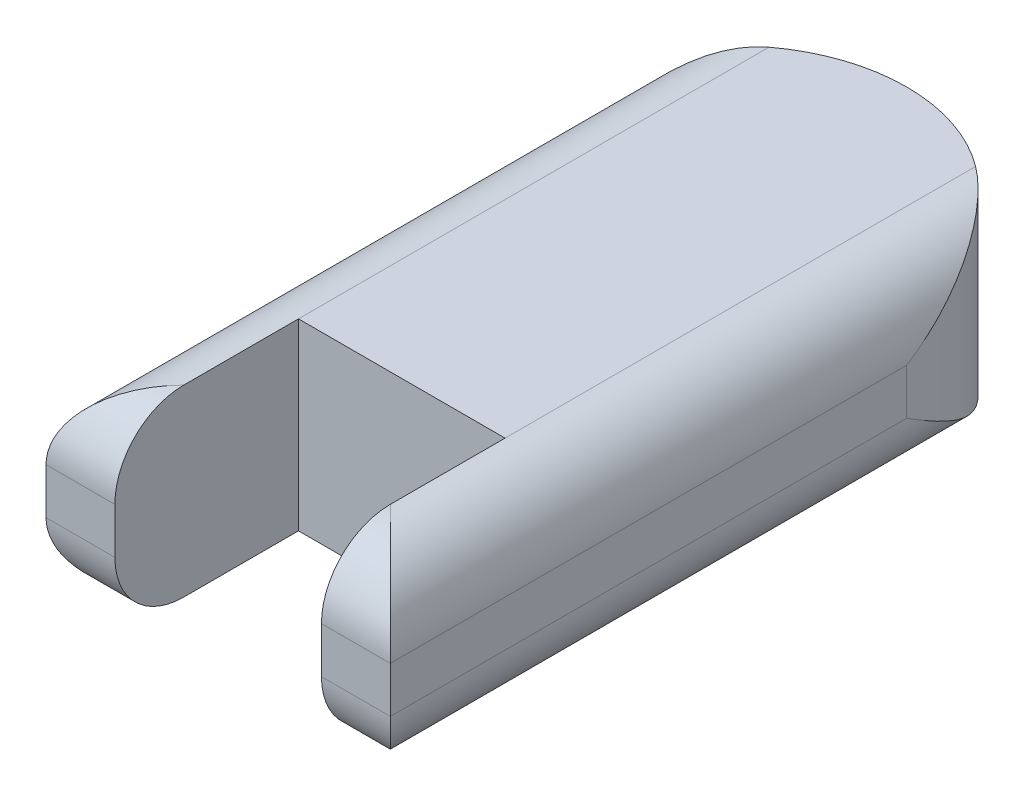
from build123d import *

# Parameters (mm, degrees)
BOSS_EXTRUDE1_DEPTH      = 150
BOSS_EXTRUDE1_DEPTH_BACK = 150
SKETCH2_OUTSIDE_W        = 370.964
SKETCH2_OUTSIDE_H        = 150.964
CUT_EXTRUDE1_DEPTH       = 150
CUT_EXTRUDE2_REACH       = 187.809
SKETCH6_OUTSIDE_W        = 220.96400000000003
SKETCH6_OUTSIDE_H        = 370.964
CUT_EXTRUDE3_DEPTH       = 186.8090417606205


with BuildPart() as part:
    # Sketch1 → Boss-Extrude1 (new, two sides: drawn at the far end of the back side and taken through both)
    with BuildSketch(Plane.XY.offset(-BOSS_EXTRUDE1_DEPTH_BACK)):
        with BuildLine():
            Line((-44.999999999999986, -39.99999999999999), (45.000000000000014, -39.99999999999999))
            ThreePointArc((45.000000000000014, -39.99999999999999), (66.21320343559644, -31.21320343559642), (75.00000000000001, -10.000000000000002))
            Line((75.00000000000001, -10.000000000000002), (75.00000000000001, 10.000000000000002))
            ThreePointArc((75.00000000000001, 10.000000000000002), (66.21320343559645, 31.213203435596434), (45.000000000000014, 40.00000000000001))
            Line((45.000000000000014, 40.00000000000001), (-44.999999999999986, 40.00000000000001))
            ThreePointArc((-44.999999999999986, 40.00000000000001), (-66.21320343559641, 31.213203435596427), (-74.99999999999999, 10.000000000000002))
            Line((-74.99999999999999, 10.000000000000002), (-74.99999999999999, -10.000000000000002))
            ThreePointArc((-74.99999999999999, -10.000000000000002), (-66.2132034355964, -31.213203435596427), (-44.999999999999986, -39.99999999999999))
        make_face()
    extrude(amount=BOSS_EXTRUDE1_DEPTH + BOSS_EXTRUDE1_DEPTH_BACK)

    # Sketch2 outside → Cut-Extrude1 (cut)
    with BuildSketch(Plane(origin=(75.00000000000001, 0, 0), x_dir=(0, 0, -1), z_dir=(1, 0, 0))):
        Rectangle(SKETCH2_OUTSIDE_W, SKETCH2_OUTSIDE_H)
        with BuildLine():
            Line((150, 40.00000000000001), (-120, 39.999999999999986))
            ThreePointArc((-120, 39.999999999999986), (-141.21320343559643, 31.21320343559642), (-150, 9.999999999999991))
            Line((-150, 9.999999999999991), (-150, -9.999999999999991))
            ThreePointArc((-150, -9.999999999999991), (-141.21320343559643, -31.213203435596412), (-120, -39.999999999999986))
            Line((-120, -39.999999999999986), (150, -39.999999999999964))
            Line((150, -39.999999999999964), (150, 40.00000000000001))
        make_face(mode=Mode.SUBTRACT)
    extrude(amount=-CUT_EXTRUDE1_DEPTH, mode=Mode.SUBTRACT)

    # Sketch3 → Cut-Extrude2 (cut, up to next)
    with BuildSketch(Plane.XZ.offset(39.99999999999999), mode=Mode.PRIVATE) as cut_extrude2_sk1:
        Polygon((-44.99999999999978, 150), (45, 150), (45.000000000000014, 69.99999999999999), (-44.99999999999977, 69.99999999999999), align=None)
    cut_extrude2_tool1 = extrude(cut_extrude2_sk1.sketch, amount=-CUT_EXTRUDE2_REACH, mode=Mode.PRIVATE) & part.part
    add(cut_extrude2_tool1.solids().sort_by_distance((0, -40, 110))[0], mode=Mode.SUBTRACT)

    # Sketch6 outside → Cut-Extrude3 (cut, through all)
    with BuildSketch(Plane(origin=(0, 40.00000000000001, 0), x_dir=(1, 0, 0), z_dir=(0, 1, 0))):
        Rectangle(SKETCH6_OUTSIDE_W, SKETCH6_OUTSIDE_H)
        with BuildLine():
            Line((-75, 75), (-74.99999999999999, 0))
            Line((-74.99999999999999, 0), (-74.99999999999999, -150))
            Line((-74.99999999999999, -150), (75.00000000000001, -150))
            Line((75.00000000000001, -150), (75.00000000000001, 0))
            Line((75.00000000000001, 0), (75, 75))
            ThreePointArc((75, 75), (-9.29e-15, 149.99999999999997), (-75, 75))
        make_face(mode=Mode.SUBTRACT)
    extrude(amount=-CUT_EXTRUDE3_DEPTH, mode=Mode.SUBTRACT)


solid = part.part
